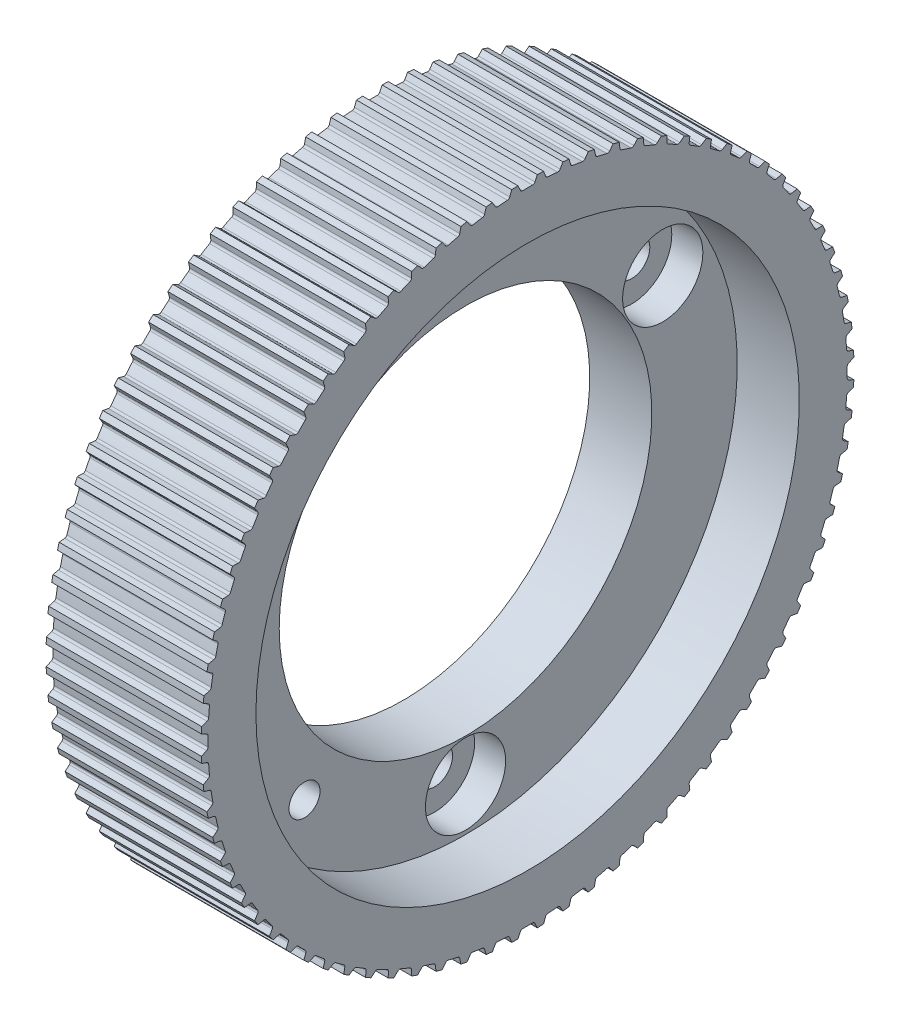
from build123d import *

# Parameters (mm, degrees)
ENL_V_MAT_EXTRU_1_REACH      = 92.965
ESQUISSE2_R                  = 3
ESQUISSE2_R_2                = 3.5
ESQUISSE3_R                  = 7.75
ENL_V_MAT_EXTRU_3_DEPTH      = 6
R_P_TITION_CIRCULAIRE1_COUNT = 3
ENL_V_MAT_EXTRU_4_REACH      = 96.078
R_P_TITION_CIRCULAIRE2_COUNT = 80


with BuildPart() as part:
    # Esquisse1 → Révolution1 (revolve)
    with BuildSketch(Plane.XY, mode=Mode.PRIVATE) as r_volution1_sk:
        Polygon((0, 36), (0, 49), (-6, 49), (-6, 63.05), (24, 63.05), (24, 52.5), (12, 52.5), (12, 36), align=None)
    revolve(r_volution1_sk.sketch.rotate(Axis((-35.322537563, 0, 0), (1, 0, 0)), 90), axis=Axis((-35.322537563, 0, 0), (1, 0, 0)))

    # Esquisse2 → Enlèv. mat.-Extru.1 (cut, up to next)
    with BuildSketch(Plane(origin=(12, 0, 0), x_dir=(0, 0, -1), z_dir=(1, 0, 0)), mode=Mode.PRIVATE) as enl_v_mat_extru_1_sk1:
        with Locations((0, 44)):
            Circle(ESQUISSE2_R)
    enl_v_mat_extru_1_tool1 = extrude(enl_v_mat_extru_1_sk1.sketch, amount=-ENL_V_MAT_EXTRU_1_REACH, mode=Mode.PRIVATE) & part.part
    # Esquisse2 → Enlèv. mat.-Extru.1 (cut, up to next)
    with BuildSketch(Plane(origin=(12, 0, 0), x_dir=(0, 0, -1), z_dir=(1, 0, 0)), mode=Mode.PRIVATE) as enl_v_mat_extru_1_sk2:
        with Locations((-31.112698372, -31.112698372)):
            Circle(ESQUISSE2_R)
    enl_v_mat_extru_1_tool2 = extrude(enl_v_mat_extru_1_sk2.sketch, amount=-ENL_V_MAT_EXTRU_1_REACH, mode=Mode.PRIVATE) & part.part
    # Esquisse2 → Enlèv. mat.-Extru.1 (cut, up to next)
    with BuildSketch(Plane(origin=(12, 0, 0), x_dir=(0, 0, -1), z_dir=(1, 0, 0)), mode=Mode.PRIVATE) as enl_v_mat_extru_1_sk3:
        with Locations((0, -44)):
            Circle(ESQUISSE2_R_2)
    enl_v_mat_extru_1_tool3 = extrude(enl_v_mat_extru_1_sk3.sketch, amount=-ENL_V_MAT_EXTRU_1_REACH, mode=Mode.PRIVATE) & part.part
    # Esquisse2 → Enlèv. mat.-Extru.1 (cut, up to next)
    with BuildSketch(Plane(origin=(12, 0, 0), x_dir=(0, 0, -1), z_dir=(1, 0, 0)), mode=Mode.PRIVATE) as enl_v_mat_extru_1_sk4:
        with Locations((-38.105117767, 22)):
            Circle(ESQUISSE2_R_2)
    enl_v_mat_extru_1_tool4 = extrude(enl_v_mat_extru_1_sk4.sketch, amount=-ENL_V_MAT_EXTRU_1_REACH, mode=Mode.PRIVATE) & part.part
    # Esquisse2 → Enlèv. mat.-Extru.1 (cut, up to next)
    with BuildSketch(Plane(origin=(12, 0, 0), x_dir=(0, 0, -1), z_dir=(1, 0, 0)), mode=Mode.PRIVATE) as enl_v_mat_extru_1_sk5:
        with Locations((38.105117767, 22)):
            Circle(ESQUISSE2_R_2)
    enl_v_mat_extru_1_tool5 = extrude(enl_v_mat_extru_1_sk5.sketch, amount=-ENL_V_MAT_EXTRU_1_REACH, mode=Mode.PRIVATE) & part.part
    add(enl_v_mat_extru_1_tool1.solids().sort_by_distance((12, 44, 0))[0], mode=Mode.SUBTRACT)
    add(enl_v_mat_extru_1_tool2.solids().sort_by_distance((12, -31.112698, 31.112698))[0], mode=Mode.SUBTRACT)
    add(enl_v_mat_extru_1_tool3.solids().sort_by_distance((12, -44, 0))[0], mode=Mode.SUBTRACT)
    add(enl_v_mat_extru_1_tool4.solids().sort_by_distance((12, 22, 38.105118))[0], mode=Mode.SUBTRACT)
    add(enl_v_mat_extru_1_tool5.solids().sort_by_distance((12, 22, -38.105118))[0], mode=Mode.SUBTRACT)

    # Esquisse3 → Enlèv. mat.-Extru.3 (cut)
    with BuildSketch(Plane(origin=(12, 0, 0), x_dir=(0, 0, -1), z_dir=(1, 0, 0))):
        with Locations((0, -44)):
            Circle(ESQUISSE3_R)
    enl_v_mat_extru_3 = extrude(amount=-ENL_V_MAT_EXTRU_3_DEPTH, mode=Mode.SUBTRACT)

    # Répétition circulaire1: Enlèv. mat.-Extru.3 ×3 about axis
    r_p_tition_circulaire1_axis = Axis((0, 0, 0), (1, 0, 0))
    for i in range(1, R_P_TITION_CIRCULAIRE1_COUNT):
        add(enl_v_mat_extru_3.rotate(r_p_tition_circulaire1_axis, i * 360 / R_P_TITION_CIRCULAIRE1_COUNT), mode=Mode.SUBTRACT)

    # Esquisse4 → Enlèv. mat.-Extru.4 (cut, up to next)
    with BuildSketch(Plane(origin=(24, 0, 0), x_dir=(0, 0, -1), z_dir=(1, 0, 0)), mode=Mode.PRIVATE) as enl_v_mat_extru_4_sk1:
        with BuildLine():
            Line((-2.155, 63.633520058), (-1.40790458, 62.031368761))
            ThreePointArc((-1.40790458, 62.031368761), (-1.220158646, 61.818934319), (-0.947082007, 61.742736704))
            ThreePointArc((-0.947082007, 61.742736704), (0, 61.75), (0.947082007, 61.742736704))
            ThreePointArc((0.947082007, 61.742736704), (1.220158646, 61.818934319), (1.40790458, 62.031368761))
            Line((1.40790458, 62.031368761), (2.155, 63.633520058))
            ThreePointArc((2.155, 63.633520058), (0, 63.67), (-2.155, 63.633520058))
        make_face()
    enl_v_mat_extru_4_tool1 = extrude(enl_v_mat_extru_4_sk1.sketch, amount=-ENL_V_MAT_EXTRU_4_REACH, mode=Mode.PRIVATE) & part.part
    enl_v_mat_extru_4 = enl_v_mat_extru_4_tool1.solids().sort_by_distance((24, 62.789836, 0))[0]
    add(enl_v_mat_extru_4, mode=Mode.SUBTRACT)

    # Répétition circulaire2: Enlèv. mat.-Extru.4 ×80 about axis
    r_p_tition_circulaire2_axis = Axis((0, 0, 0), (1, 0, 0))
    for i in range(1, R_P_TITION_CIRCULAIRE2_COUNT):
        add(enl_v_mat_extru_4.rotate(r_p_tition_circulaire2_axis, i * 360 / R_P_TITION_CIRCULAIRE2_COUNT), mode=Mode.SUBTRACT)


solid = part.part
